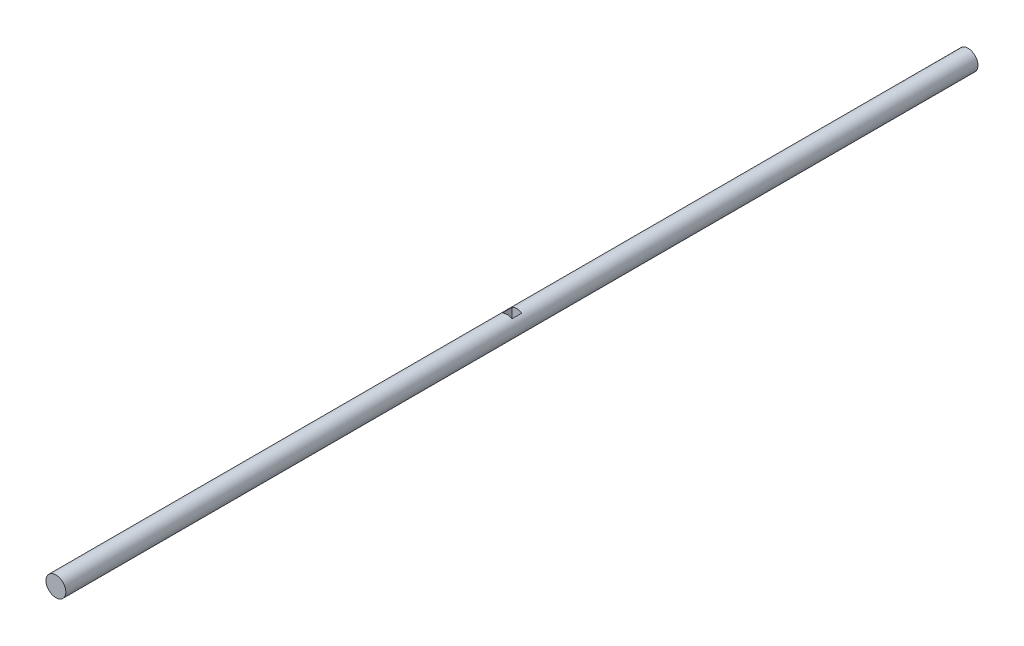
from build123d import *

# Parameters (mm, degrees)
CROQUIS1_R              = 2.5
SALIENTE_EXTRUIR1_DEPTH = 230
CROQUIS2_W              = 2.5
CROQUIS2_H              = 2.5
CORTAR_EXTRUIR1_DEPTH   = 5


with BuildPart() as part:
    # Croquis1 → Saliente-Extruir1 (new body)
    with BuildSketch(Plane.XY):
        Circle(CROQUIS1_R)
    extrude(amount=SALIENTE_EXTRUIR1_DEPTH)

    # Croquis2 → Cortar-Extruir1 (cut, symmetric)
    with BuildSketch(Plane(origin=(0, 0, 0), x_dir=(1, 0, 0), z_dir=(0, 1, 0))):
        with Locations((0, -115)):
            Rectangle(CROQUIS2_W, CROQUIS2_H)
    extrude(amount=CORTAR_EXTRUIR1_DEPTH, both=True, mode=Mode.SUBTRACT)


solid = part.part
